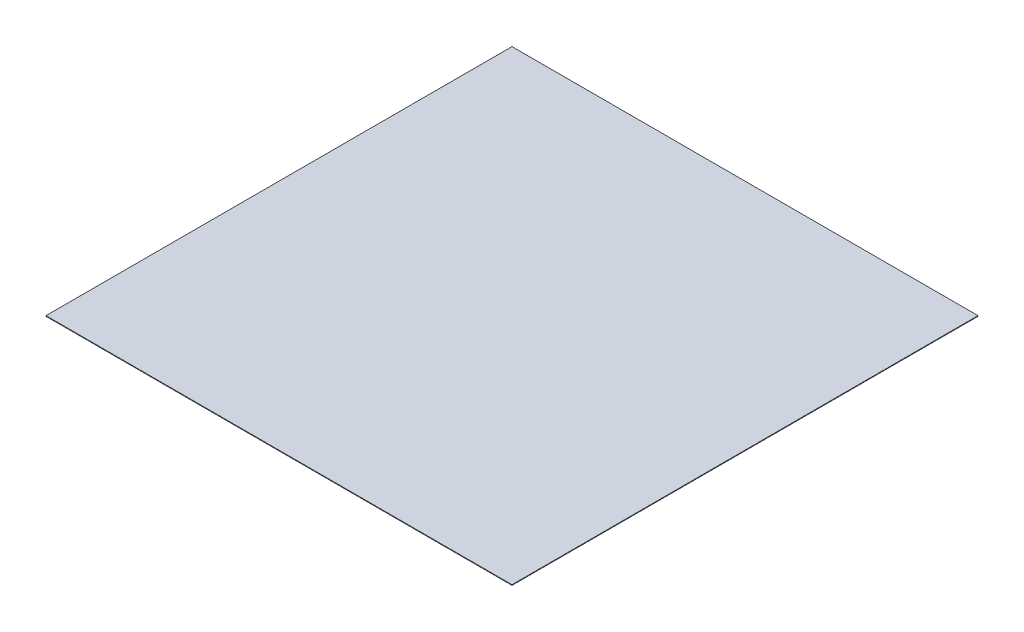
from build123d import *

# Parameters (mm, degrees)
SKETCH1_W           = 190
SKETCH1_H           = 190
BOSS_EXTRUDE1_DEPTH = 0.125


with BuildPart() as part:
    # Sketch1 → Boss-Extrude1 (new, symmetric)
    with BuildSketch(Plane(origin=(0, 0, 0), x_dir=(1, 0, 0), z_dir=(0, 1, 0))):
        Rectangle(SKETCH1_W, SKETCH1_H)
    extrude(amount=BOSS_EXTRUDE1_DEPTH, both=True)


solid = part.part
